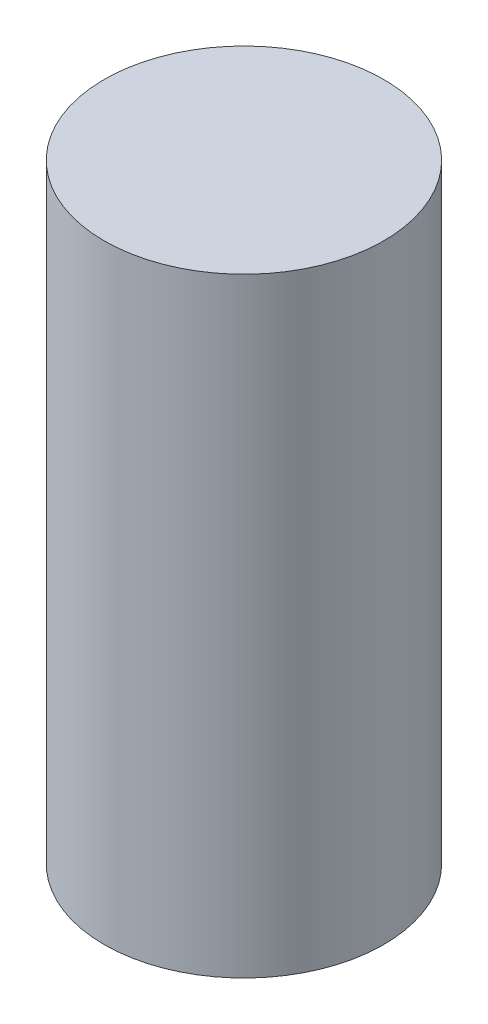
from build123d import *

# Parameters (mm, degrees)
SKETCH1_R           = 0.635
BOSS_EXTRUDE1_DEPTH = 2.7686


with BuildPart() as part:
    # Sketch1 → Boss-Extrude1 (new body)
    with BuildSketch(Plane(origin=(0, 0, 0), x_dir=(1, 0, 0), z_dir=(0, 1, 0))):
        with Locations(Location((0, 0, 0), (0, 0, 270))):
            Circle(SKETCH1_R)
    extrude(amount=BOSS_EXTRUDE1_DEPTH)


solid = part.part
